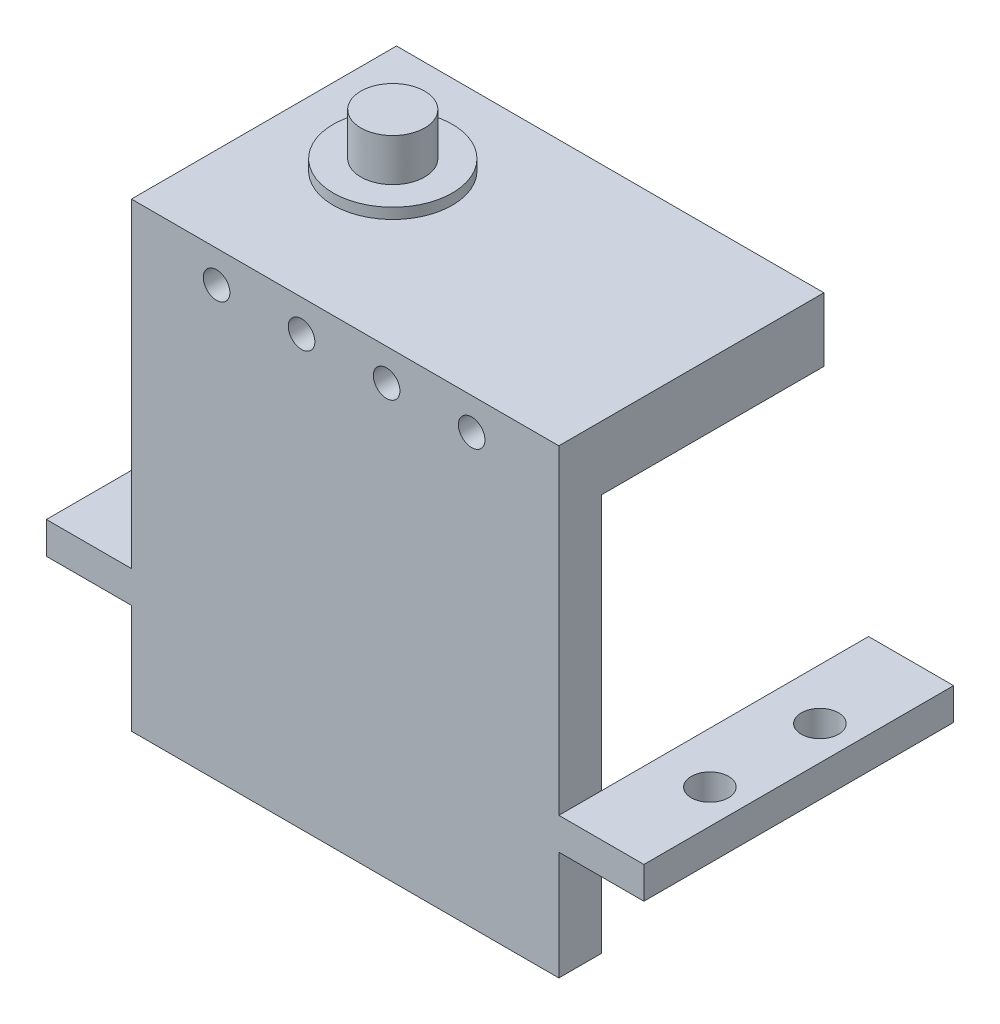
from build123d import *

# Parameters (mm, degrees)
BOSS_EXTRUDE2_DEPTH       = 4
SKETCH6_W                 = 8
SKETCH6_H                 = 3
BOSS_EXTRUDE3_DEPTH       = 25.13
SKETCH7_W                 = 8
SKETCH7_H                 = 3
BOSS_EXTRUDE4_DEPTH       = 25.13
SKETCH32_W                = 40.2
SKETCH32_H                = 6
BOSS_EXTRUDE6_DEPTH       = 20.93
SKETCH33_R                = 3.5
BOSS_EXTRUDE9_DEPTH       = 5.05
SKETCH63_R                = 5.6
BOSS_EXTRUDE16_DEPTH      = 1
SKETCH70_R                = 1.75
CUT_EXTRUDE23_DEPTH       = 5
SKETCH71_R                = 1.75
CUT_EXTRUDE24_DEPTH       = 6
CUT_EXTRUDE26_DEPTH       = 10
CUT_EXTRUDE26_DEPTH_BACK  = 25
SKETCH86_R                = 1.25
SKETCH88_W                = 40.2
SKETCH88_H                = 4
BOSS_EXTRUDE26_DEPTH      = 6
CUT_EXTRUDE28_DEPTH       = 4
CUT_EXTRUDE28_DEPTH_BACK  = 30
SKETCH89_R                = 1.25
BOSS_EXTRUDE27_DEPTH      = 4
BOSS_EXTRUDE27_DEPTH_BACK = 2
SKETCH90_R                = 3


with BuildPart() as part:
    # Sketch5 → Boss-Extrude2 (new body)
    with BuildSketch(Plane.XY):
        Polygon((-138.644230049, -41.159116495), (-138.644230049, -51.409116495), (-98.444230049, -51.409116495), (-98.444230049, -41.159116495), (-90.444230049, -41.159116495), (-90.444230049, -38.159116495), (-98.444230049, -38.159116495), (-98.444230049, -14.059116495), (-138.644230049, -14.059116495), (-138.644230049, -38.159116495), (-146.644230049, -38.159116495), (-146.644230049, -41.159116495), align=None)
    extrude(amount=BOSS_EXTRUDE2_DEPTH)

    # Sketch6 → Boss-Extrude3 (add)
    with BuildSketch(Plane(origin=(0, 0, 0), x_dir=(-1, 0, 0), z_dir=(0, 0, -1))):
        with Locations((142.644230049, -39.659116495)):
            Rectangle(SKETCH6_W, SKETCH6_H)
    extrude(amount=BOSS_EXTRUDE3_DEPTH)

    # Sketch7 → Boss-Extrude4 (add)
    with BuildSketch(Plane(origin=(0, 0, 0), x_dir=(-1, 0, 0), z_dir=(0, 0, -1))):
        with Locations((94.444230049, -39.659116495)):
            Rectangle(SKETCH7_W, SKETCH7_H)
    extrude(amount=BOSS_EXTRUDE4_DEPTH)

    # Sketch70 → Cut-Extrude23 (cut)
    with BuildSketch(Plane(origin=(0, -38.159116495, 0), x_dir=(1, 0, 0), z_dir=(0, 1, 0))):
        with Locations((-93.644230062, 15.755)):
            Circle(SKETCH70_R)
        with Locations((-93.644230062, 5.405)):
            Circle(SKETCH70_R)
    extrude(amount=-CUT_EXTRUDE23_DEPTH, mode=Mode.SUBTRACT)

    # Sketch71 → Cut-Extrude24 (cut)
    with BuildSketch(Plane(origin=(0, -41.159116495, 0), x_dir=(-1, 0, 0), z_dir=(0, -1, 0))):
        with Locations((143.444230049, 15.755)):
            Circle(SKETCH71_R)
        with Locations((143.444230049, 5.405)):
            Circle(SKETCH71_R)
    extrude(amount=-CUT_EXTRUDE24_DEPTH, mode=Mode.SUBTRACT)



with BuildPart() as body_2:
    # Sketch32 → Boss-Extrude6 (new body)
    with BuildSketch(Plane(origin=(0, 0, 0), x_dir=(-1, 0, 0), z_dir=(0, 0, -1))):
        with Locations((118.544230049, -11.059116495)):
            Rectangle(SKETCH32_W, SKETCH32_H)
    extrude(amount=BOSS_EXTRUDE6_DEPTH)

    # Sketch33 → Boss-Extrude9 (add)
    with BuildSketch(Plane(origin=(0.053304524, -14.059116495, 0), x_dir=(1, 0, 0), z_dir=(0, 1, 0))):
        with Locations((-128.616195309, 10.145060344)):
            Circle(SKETCH33_R)
    extrude(amount=BOSS_EXTRUDE9_DEPTH)

    # Sketch86 → Cut-Extrude26 (cut, two sides: drawn at the far end of the back side and taken through both)
    with BuildSketch(Plane(origin=(0, 0, -20.93), x_dir=(-1, 0, 0), z_dir=(0, 0, -1)).offset(-CUT_EXTRUDE26_DEPTH_BACK)):
        with Locations((122.644230049, -11.0591165)):
            Circle(SKETCH86_R)
        with Locations((114.644230049, -11.0591165)):
            Circle(SKETCH86_R)
        with Locations((106.644230049, -11.0591165)):
            Circle(SKETCH86_R)
    extrude(amount=CUT_EXTRUDE26_DEPTH + CUT_EXTRUDE26_DEPTH_BACK, mode=Mode.SUBTRACT)


with BuildPart() as body_3:
    # Sketch63 → Boss-Extrude16 (new body)
    with BuildSketch(Plane(origin=(0.038379059, -8.059116495, 0), x_dir=(1, 0, 0), z_dir=(0, 1, 0))):
        with Locations((-128.682609121, 10.58)):
            Circle(SKETCH63_R)
    extrude(amount=BOSS_EXTRUDE16_DEPTH)

    # Sketch90 → Boss-Extrude27 (add, two sides: drawn at the far end of the back side and taken through both)
    with BuildSketch(Plane(origin=(0, -7.059116495, 0), x_dir=(1, 0, 0), z_dir=(0, 1, 0)).offset(-BOSS_EXTRUDE27_DEPTH_BACK)):
        with Locations((-128.644230062, 10.58)):
            Circle(SKETCH90_R)
    extrude(amount=BOSS_EXTRUDE27_DEPTH + BOSS_EXTRUDE27_DEPTH_BACK)


with BuildPart() as part_1:
    add(part.part)

    add(body_2.part)  # Boss-Extrude26 merges body 2
    # Sketch88 → Boss-Extrude26 (add)
    with BuildSketch(Plane(origin=(0, -14.059116495, 0), x_dir=(1, 0, 0), z_dir=(0, 1, 0))):
        with Locations((-118.544230049, -2)):
            Rectangle(SKETCH88_W, SKETCH88_H)
    extrude(amount=BOSS_EXTRUDE26_DEPTH)

    # Sketch89 → Cut-Extrude28 (cut, two sides: drawn at the far end of the back side and taken through both)
    with BuildSketch(Plane.XY.offset(4).offset(-CUT_EXTRUDE28_DEPTH_BACK)):
        with Locations((-130.636250743, -11.059116495)):
            Circle(SKETCH89_R)
        with Locations((-122.644230049, -11.059116495)):
            Circle(SKETCH89_R)
        with Locations((-114.644230049, -11.059116495)):
            Circle(SKETCH89_R)
        with Locations((-106.644230049, -11.059116495)):
            Circle(SKETCH89_R)
    extrude(amount=CUT_EXTRUDE28_DEPTH + CUT_EXTRUDE28_DEPTH_BACK, mode=Mode.SUBTRACT)


solid = Compound([body_3.part, part_1.part])
